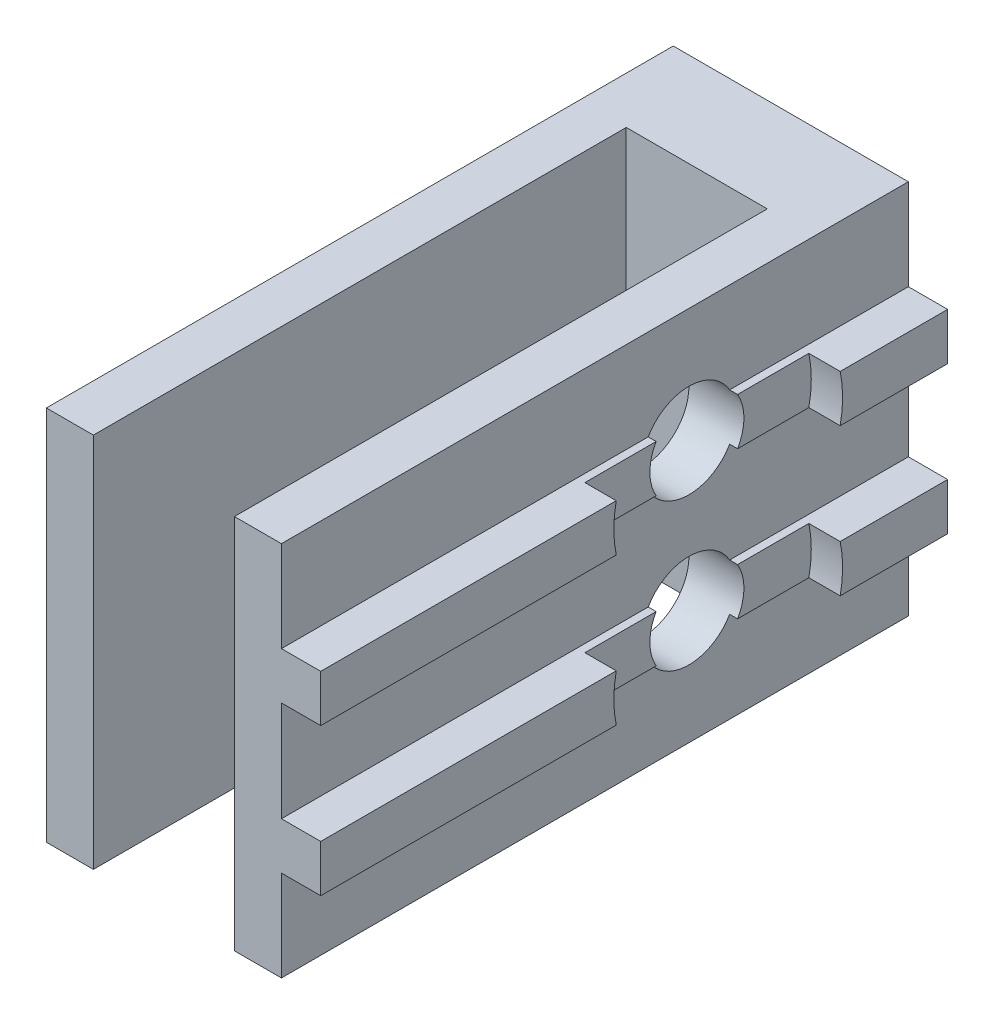
from build123d import *

# Parameters (mm, degrees)
BOSS_EXTRUDE1_DEPTH = 20
SKETCH2_W           = 4.5
SKETCH2_H           = 12
CUT_EXTRUDE1_DEPTH  = 17
SKETCH3_R           = 1.5
CUT_EXTRUDE2_DEPTH  = 1
SKETCH3_3_R         = 1.5
CUT_EXTRUDE3_DEPTH  = 7.253189388


with BuildPart() as part:
    # Sketch1 → Boss-Extrude1 (new body)
    with BuildSketch(Plane.XY):
        Polygon((7.5, 9.1), (8.753189388, 9.1), (8.753189388, 7.6), (7.5, 7.6), (7.5, 4.4), (8.753189388, 4.4), (8.753189388, 2.9), (7.5, 2.9), (7.5, 0), (0, 0), (0, 12), (7.5, 12), align=None)
    extrude(amount=BOSS_EXTRUDE1_DEPTH)

    # Sketch2 → Cut-Extrude1 (cut)
    with BuildSketch(Plane.XY.offset(20)):
        with Locations((3.75, 6)):
            Rectangle(SKETCH2_W, SKETCH2_H)
    extrude(amount=-CUT_EXTRUDE1_DEPTH, mode=Mode.SUBTRACT)

    # Sketch3 → Cut-Extrude2 (cut)
    # profile 1 of 6: a face of its own
    with BuildSketch(Plane(origin=(8.753189388, 0, 0), x_dir=(0, 0, -1), z_dir=(1, 0, 0))):
        with BuildLine():
            Line((-5.700961894, 7.6), (-3.42788578, 7.6))
            ThreePointArc((-3.42788578, 7.6), (-3.35, 8.35), (-3.42788578, 9.1))
            Line((-3.42788578, 9.1), (-5.700961894, 9.1))
            ThreePointArc((-5.700961894, 9.1), (-5.551111261, 8.738228568), (-5.5, 8.35))
            ThreePointArc((-5.5, 8.35), (-5.551111261, 7.961771432), (-5.700961894, 7.6))
        make_face()
    # profile 2 of 6: a face of its own
    with BuildSketch(Plane(origin=(8.753189388, 0, 0), x_dir=(0, 0, -1), z_dir=(1, 0, 0))):
        with BuildLine():
            ThreePointArc((-10.57211422, 9.1), (-10.65, 8.35), (-10.57211422, 7.6))
            Line((-10.57211422, 7.6), (-8.299038106, 7.6))
            ThreePointArc((-8.299038106, 7.6), (-8.5, 8.35), (-8.299038106, 9.1))
            Line((-8.299038106, 9.1), (-10.57211422, 9.1))
        make_face()
    # profile 3 of 6: a face of its own
    with BuildSketch(Plane(origin=(8.753189388, 0, 0), x_dir=(0, 0, -1), z_dir=(1, 0, 0))):
        with BuildLine():
            ThreePointArc((-9.792848009, 6), (-7, 0), (-4.207151991, 6))
            ThreePointArc((-4.207151991, 6), (-3.718508564, 6.751777876), (-3.42788578, 7.6))
            Line((-3.42788578, 7.6), (-5.700961894, 7.6))
            ThreePointArc((-5.700961894, 7.6), (-7, 6.85), (-8.299038106, 7.6))
            Line((-8.299038106, 7.6), (-10.57211422, 7.6))
            ThreePointArc((-10.57211422, 7.6), (-10.281491436, 6.751777876), (-9.792848009, 6))
        make_face()
        with Locations((-7, 3.65)):
            Circle(SKETCH3_R, mode=Mode.SUBTRACT)
    # profile 4 of 6: a face of its own
    with BuildSketch(Plane(origin=(8.753189388, 0, 0), x_dir=(0, 0, -1), z_dir=(1, 0, 0))):
        with BuildLine():
            Line((-5.700961894, 9.1), (-3.42788578, 9.1))
            ThreePointArc((-3.42788578, 9.1), (-7, 12), (-10.57211422, 9.1))
            Line((-10.57211422, 9.1), (-8.299038106, 9.1))
            ThreePointArc((-8.299038106, 9.1), (-7, 9.85), (-5.700961894, 9.1))
        make_face()
    # profile 5 of 6: a face of its own
    with BuildSketch(Plane(origin=(8.753189388, 0, 0), x_dir=(0, 0, -1), z_dir=(1, 0, 0))):
        with BuildLine():
            Line((-5.700961894, 7.6), (-3.42788578, 7.6))
            ThreePointArc((-3.42788578, 7.6), (-3.35, 8.35), (-3.42788578, 9.1))
            Line((-3.42788578, 9.1), (-5.700961894, 9.1))
            ThreePointArc((-5.700961894, 9.1), (-5.551111261, 8.738228568), (-5.5, 8.35))
            ThreePointArc((-5.5, 8.35), (-5.551111261, 7.961771432), (-5.700961894, 7.6))
        make_face()
    # profile 6 of 6: a face of its own
    with BuildSketch(Plane(origin=(8.753189388, 0, 0), x_dir=(0, 0, -1), z_dir=(1, 0, 0))):
        with BuildLine():
            ThreePointArc((-10.57211422, 9.1), (-10.65, 8.35), (-10.57211422, 7.6))
            Line((-10.57211422, 7.6), (-8.299038106, 7.6))
            ThreePointArc((-8.299038106, 7.6), (-8.5, 8.35), (-8.299038106, 9.1))
            Line((-8.299038106, 9.1), (-10.57211422, 9.1))
        make_face()
    extrude(amount=-CUT_EXTRUDE2_DEPTH, mode=Mode.SUBTRACT)

    # Sketch3<3> → Cut-Extrude3 (cut)
    with BuildSketch(Plane(origin=(8.753189388, 0, 0), x_dir=(0, 0, -1), z_dir=(1, 0, 0))):
        with BuildLine():
            Line((-8.299038106, 7.6), (-5.700961894, 7.6))
            ThreePointArc((-5.700961894, 7.6), (-5.551111261, 7.961771432), (-5.5, 8.35))
            ThreePointArc((-5.5, 8.35), (-5.551111261, 8.738228568), (-5.700961894, 9.1))
            Line((-5.700961894, 9.1), (-8.299038106, 9.1))
            ThreePointArc((-8.299038106, 9.1), (-8.5, 8.35), (-8.299038106, 7.6))
        make_face()
        with BuildLine():
            ThreePointArc((-8.299038106, 7.6), (-7, 6.85), (-5.700961894, 7.6))
            Line((-5.700961894, 7.6), (-8.299038106, 7.6))
        make_face()
        with BuildLine():
            Line((-8.299038106, 9.1), (-5.700961894, 9.1))
            ThreePointArc((-5.700961894, 9.1), (-7, 9.85), (-8.299038106, 9.1))
        make_face()
        with Locations(Location((-7, 3.65, 0), (0, 0, 30))):
            Circle(SKETCH3_3_R)
    extrude(amount=-CUT_EXTRUDE3_DEPTH, mode=Mode.SUBTRACT)


solid = part.part
